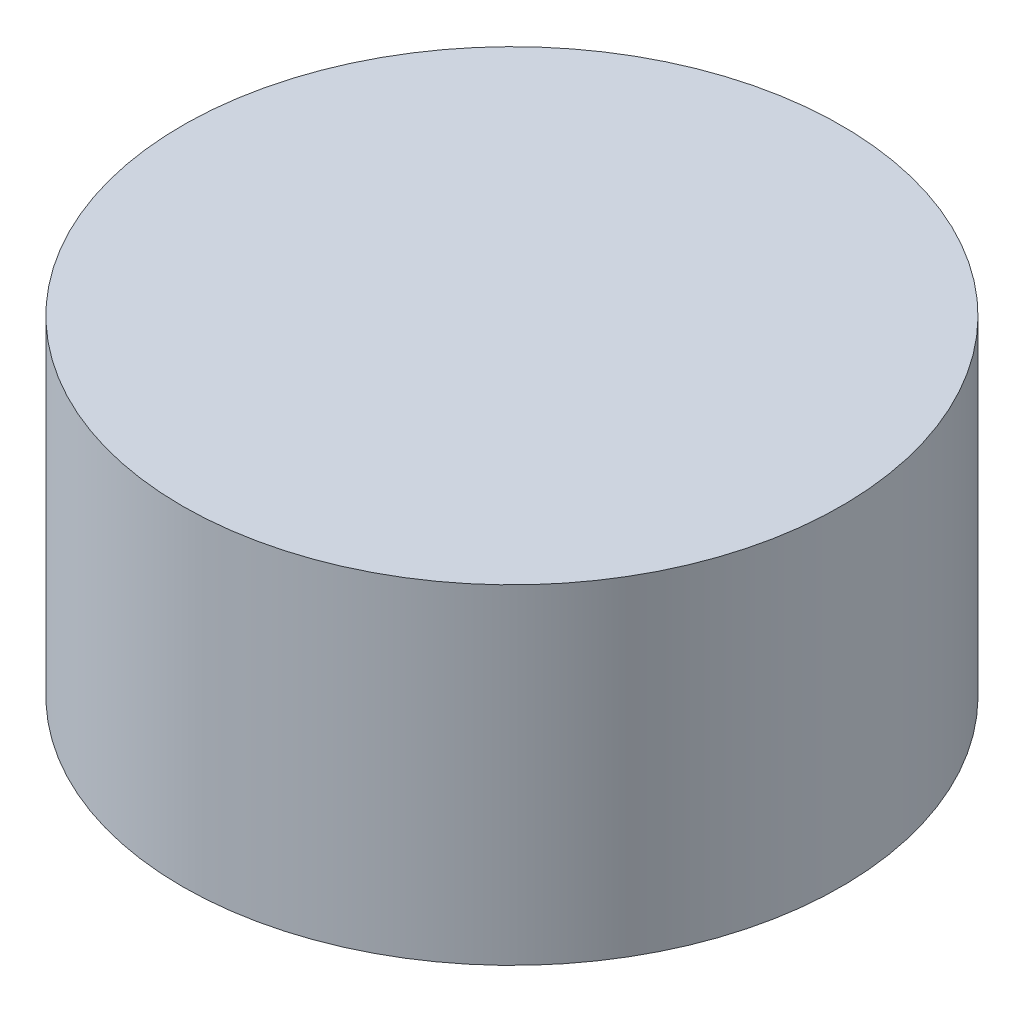
from build123d import *

# Parameters (mm, degrees)
SKETCH1_R           = 4
BOSS_EXTRUDE1_DEPTH = 4


with BuildPart() as part:
    # Sketch1 → Boss-Extrude1 (new body)
    with BuildSketch(Plane(origin=(0, 0, 0), x_dir=(1, 0, 0), z_dir=(0, 1, 0))):
        with Locations(Location((0, 0, 0), (0, 0, 270))):
            Circle(SKETCH1_R)
    extrude(amount=BOSS_EXTRUDE1_DEPTH)


solid = part.part
